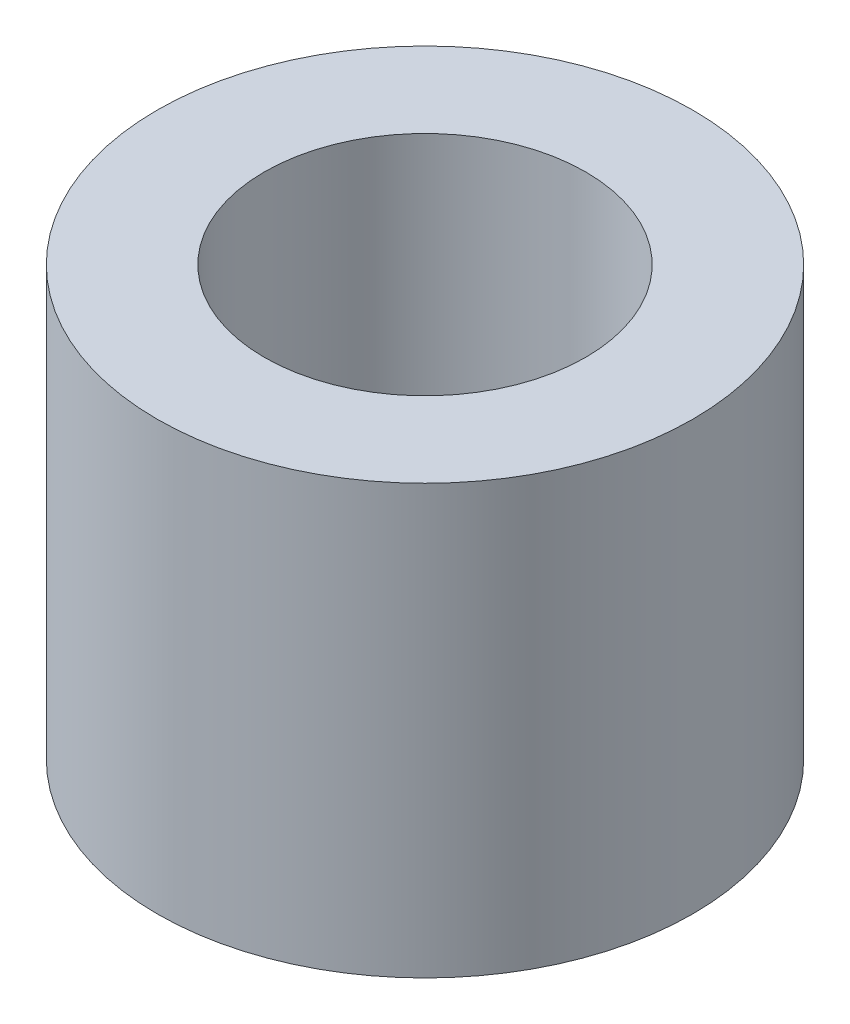
from build123d import *

# Parameters (mm, degrees)
SKETCH_1_R      = 5
SKETCH_1_R_2    = 3
EXTRUDE_1_DEPTH = 8


with BuildPart() as part:
    # 草图1 → 凸台-拉伸1 (new body)
    with BuildSketch(Plane(origin=(0, 0, 0), x_dir=(1, 0, 0), z_dir=(0, 1, 0))):
        with Locations(Location((0, 0, 0), (0, 0, 270))):
            Circle(SKETCH_1_R)
        with Locations(Location((0, 0, 0), (0, 0, 270))):
            Circle(SKETCH_1_R_2, mode=Mode.SUBTRACT)
    extrude(amount=EXTRUDE_1_DEPTH)


solid = part.part
